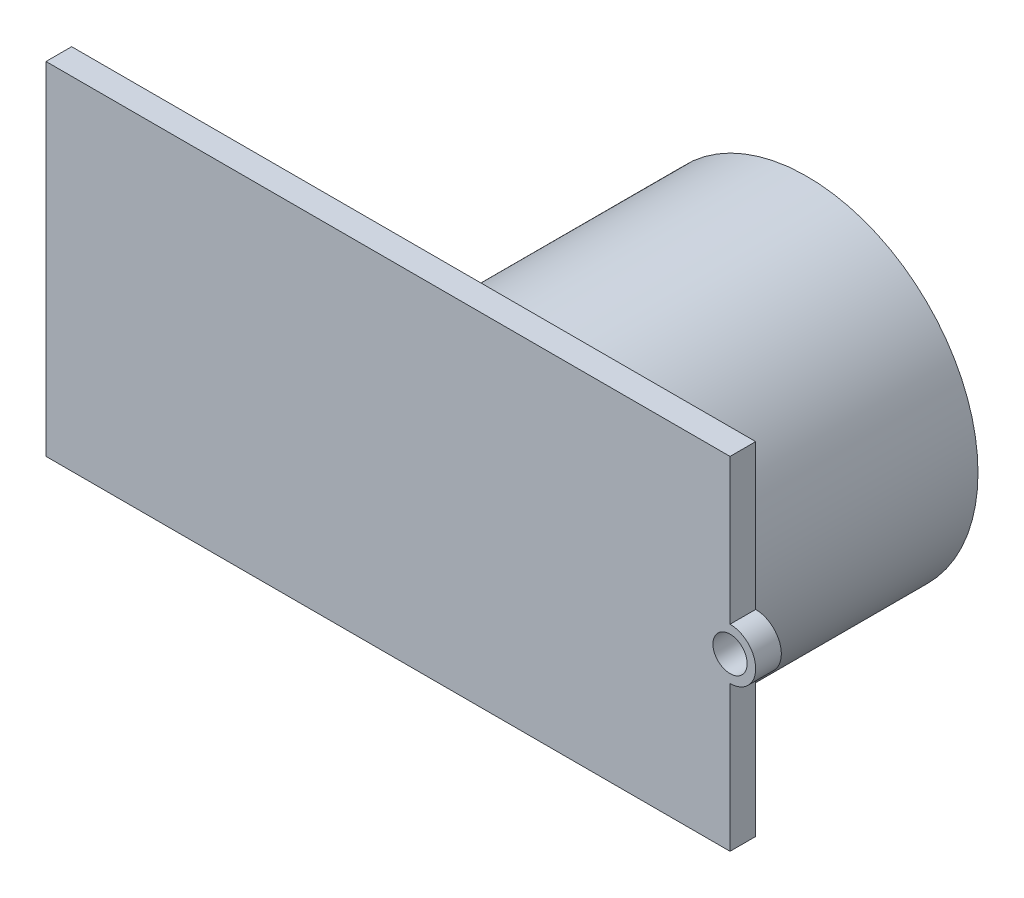
from build123d import *

# Parameters (mm, degrees)
ESQUISSE1_R        = 1
BOSS_EXTRU_2_DEPTH = 1.5
ESQUISSE2_R        = 10
BOSS_EXTRU_3_DEPTH = 15


with BuildPart() as part:
    # Esquisse1 → Boss.-Extru.2 (new body)
    with BuildSketch(Plane.XY):
        with BuildLine():
            Line((20.277172368, -9.884393064), (20.277172368, -1.384393064))
            ThreePointArc((20.277172368, -1.384393064), (21.777172368, 0.115606936), (20.277172368, 1.615606936))
            Line((20.277172368, 1.615606936), (20.277172368, 10.115606936))
            Line((20.277172368, 10.115606936), (-19.722827632, 10.115606936))
            Line((-19.722827632, 10.115606936), (-19.722827632, -9.884393064))
            Line((-19.722827632, -9.884393064), (20.277172368, -9.884393064))
        make_face()
        with Locations((20.277172368, 0.115606936)):
            Circle(ESQUISSE1_R, mode=Mode.SUBTRACT)
    extrude(amount=BOSS_EXTRU_2_DEPTH)

    # Esquisse2 → Boss.-Extru.3 (add)
    with BuildSketch(Plane.XY):
        with Locations((8.277172368, 0.047190926)):
            Circle(ESQUISSE2_R)
    extrude(amount=-BOSS_EXTRU_3_DEPTH)


solid = part.part
